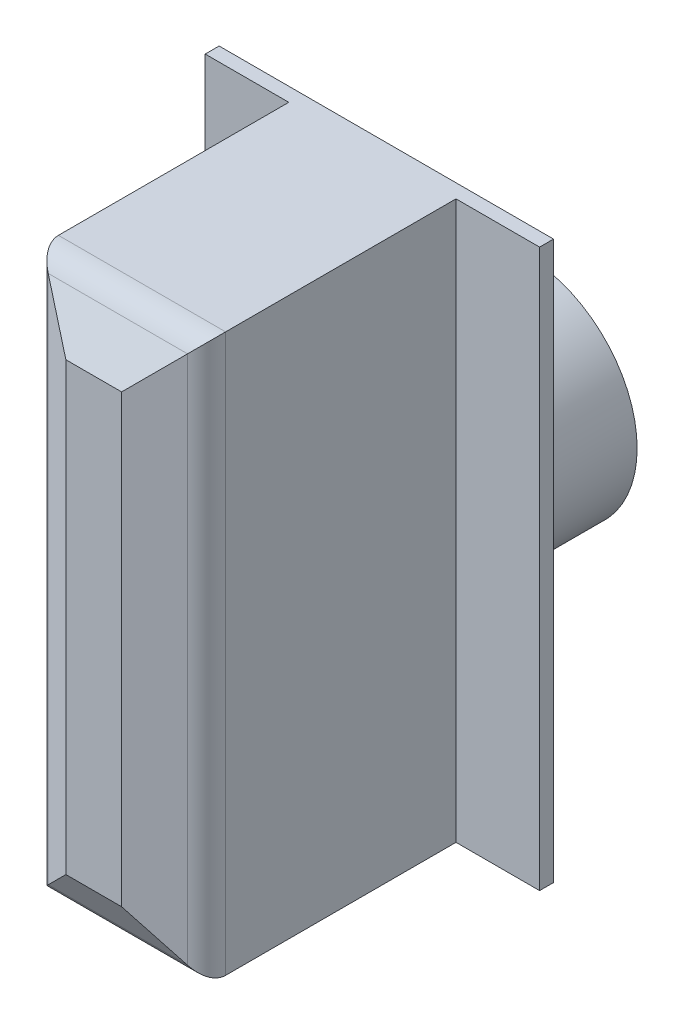
from build123d import *

# Parameters (mm, degrees)
BOSS_EXTRUDE1_DEPTH = 10
CHAMFER4_SIZE       = 1
CHAMFER4_SIZE2      = 0.577350269
FILLET3_R           = 0.5
SKETCH3_R           = 2
SKETCH3_R_2         = 1.75
BOSS_EXTRUDE3_DEPTH = 2.5


with BuildPart() as part:
    # Sketch1 → Boss-Extrude1 (new body)
    with BuildSketch(Plane(origin=(0, 0, 0), x_dir=(-1, 0, 0), z_dir=(0, 1, 0))):
        Polygon((0, 1.5), (0, 1.75), (1.5, 1.75), (1.5, 6.75), (4.5, 6.75), (4.5, 1.75), (6, 1.75), (6, 1.5), align=None)
    extrude(amount=BOSS_EXTRUDE1_DEPTH)

    # Chamfer4
    chamfer4_edges = [part.edges().sort_by_distance(p)[0] for p in [
        (-1.5, 5, 6.75),
        (-4.5, 5, 6.75),
        (-3, 10, 6.75),
        (-3, 0, 6.75),
    ]]
    chamfer4_side = [part.faces().sort_by_distance(p)[0] for p in [
        (-3, 5, 6.75),
    ]]
    chamfer(chamfer4_edges, length=CHAMFER4_SIZE, length2=CHAMFER4_SIZE2, reference=chamfer4_side[0])

    # Fillet3
    fillet3_edges = [part.edges().sort_by_distance(p)[0] for p in [
        (-4.5, 5, 6.172649731),
        (-3, 10, 6.172649731),
        (-1.5, 5, 6.172649731),
        (-3, 0, 6.172649731),
    ]]
    fillet(fillet3_edges, radius=FILLET3_R)

    # Sketch3 → Boss-Extrude3 (add)
    with BuildSketch(Plane(origin=(0, 0, 1.5), x_dir=(1, 0, 0), z_dir=(0, 0, -1))):
        with Locations((-3, -5)):
            Circle(SKETCH3_R)
        with Locations(Location((-3, -5, 0), (0, 0, 180))):
            Circle(SKETCH3_R_2, mode=Mode.SUBTRACT)
    extrude(amount=BOSS_EXTRUDE3_DEPTH)


solid = part.part
